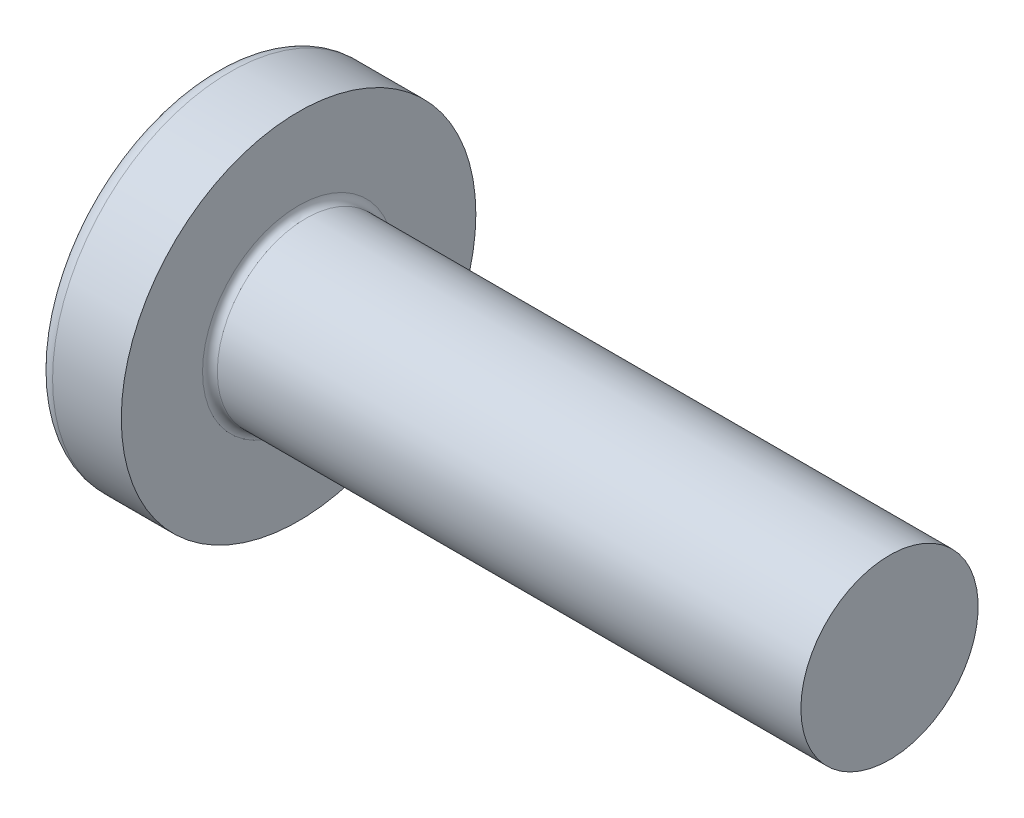
from build123d import *

# Parameters (mm, degrees)
FILLET1_R    = 0.25
RECPAT_COUNT = 2
RECPAT_ANGLE = 90


with BuildPart() as part:
    # BodySke → Base-Revolve (revolve)
    with BuildSketch(Plane.XY, mode=Mode.PRIVATE) as base_revolve_sk:
        with BuildLine():
            Line((4.6, 3), (4.6, 6))
            Line((4.6, 6), (2.274716834, 6))
            ThreePointArc((2.274716834, 6), (2.026424569, 5.939532013), (1.833738725, 5.77167019))
            ThreePointArc((1.833738725, 5.77167019), (0.469454036, 3.027985077), (0, 0))
            Line((0, 0), (24.6, 0))
            Line((24.6, 0), (24.6, 3))
            Line((24.6, 3), (4.6, 3))
        make_face()
    revolve(base_revolve_sk.sketch.rotate(Axis((2.274716834, 0, 0), (1, 0, 0)), 90), axis=Axis((2.274716834, 0, 0), (1, 0, 0)))

    # Fillet1
    fillet1_edges = [part.edges().sort_by_distance(p)[0] for p in [
        (4.6, 0, -3),
    ]]
    fillet(fillet1_edges, radius=FILLET1_R)

    # Sketch3 → Recess section 0
    with BuildSketch(Plane(origin=(0, 0, 0), x_dir=(0, 0, -1), z_dir=(1, 0, 0))):
        with BuildLine():
            Line((0.71, -3.35), (-0.71, -3.35))
            Line((-0.71, -3.35), (-0.71, 3.35))
            Line((-0.71, 3.35), (0.71, 3.35))
            Line((0.71, 3.35), (0.71, -3.35))
        make_face()
    # Sketch4 → Recess section 1
    with BuildSketch(Plane(origin=(3.46, 0, 0), x_dir=(0, 0, -1), z_dir=(1, 0, 0))):
        with BuildLine():
            Line((0.71, -1.624907925), (-0.71, -1.624907925))
            Line((-0.71, -1.624907925), (-0.71, 1.624907925))
            Line((-0.71, 1.624907925), (0.71, 1.624907925))
            Line((0.71, 1.624907925), (0.71, -1.624907925))
        make_face()
    recess = loft(mode=Mode.SUBTRACT)

    # RecPat: Recess ×2 about axis
    recpat_axis = Axis((0, 0, 0), (1, 0, 0))
    for i in range(1, RECPAT_COUNT):
        add(recess.rotate(recpat_axis, i * RECPAT_ANGLE / (RECPAT_COUNT - 1)), mode=Mode.SUBTRACT)

    # RecCorSke → RecessCore (revolve, cut)
    with BuildSketch(Plane.XY, mode=Mode.PRIVATE) as recesscore_sk:
        Polygon((0, 0), (0, 1.522446769), (3.46, 1.2805), (3.876059671, 0), align=None)
    revolve(recesscore_sk.sketch.rotate(Axis((-3.175, 0, 0), (1, 0, 0)), 12.930791927), axis=Axis((-3.175, 0, 0), (1, 0, 0)), mode=Mode.SUBTRACT)


solid = part.part
